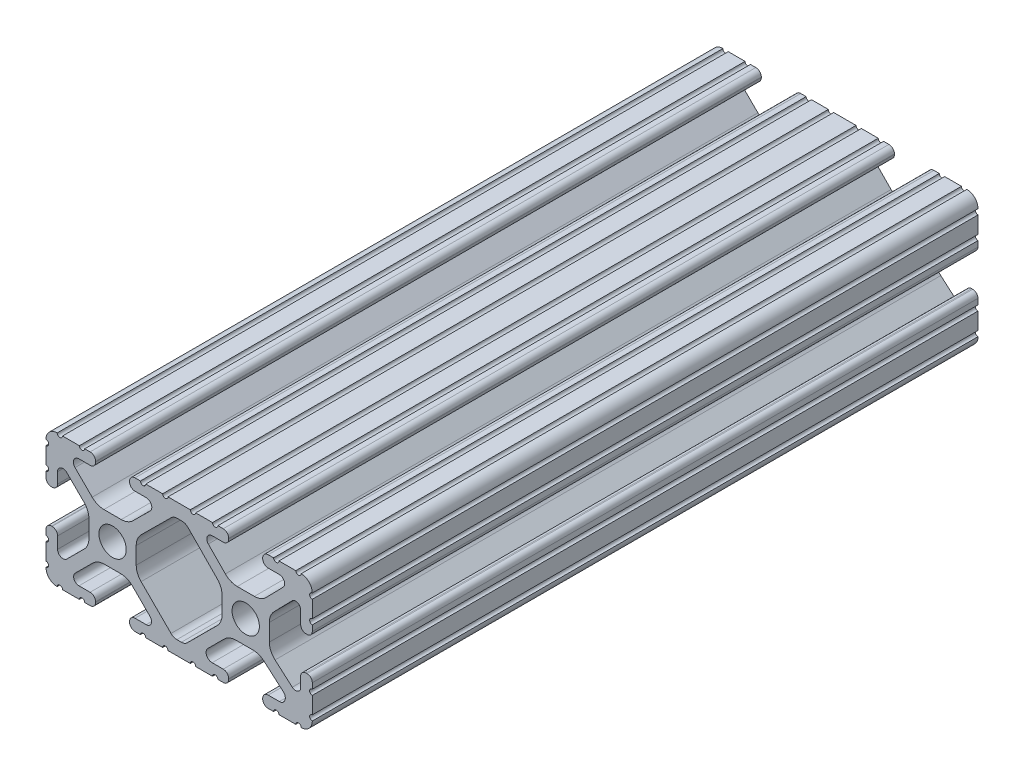
from build123d import *

# Parameters (mm, degrees)
SKETCH1_R           = 2.6035
BOSS_EXTRUDE1_DEPTH = 63.5


with BuildPart() as part:
    # Sketch1 → Boss-Extrude1 (new, symmetric)
    with BuildSketch(Plane.XY):
        with BuildLine():
            Line((18.01710265, 12.7), (16.98745015, 12.7))
            ThreePointArc((16.98745015, 12.7), (16.245730386, 12.392769614), (15.9385, 11.65104985))
            Line((15.9385, 11.65104985), (15.9385, 11.53922))
            ThreePointArc((15.9385, 11.53922), (16.245750844, 10.797450844), (16.98752, 10.4902))
            Line((16.98752, 10.4902), (19.116384363, 10.4902))
            ThreePointArc((19.116384363, 10.4902), (20.052502933, 9.869096983), (19.844087081, 8.765172272))
            Line((19.844087081, 8.765172272), (16.618993479, 5.455112286))
            ThreePointArc((16.618993479, 5.455112286), (15.578994274, 4.745442459), (14.344932584, 4.4958))
            Line((14.344932584, 4.4958), (11.083317835, 4.4958))
            ThreePointArc((11.083317835, 4.4958), (9.854330953, 4.743306833), (8.816955189, 5.447238587))
            Line((8.816955189, 5.447238587), (5.564154119, 8.762652677))
            ThreePointArc((5.564154119, 8.762652677), (5.352591412, 9.867473037), (6.289393385, 10.4902))
            Line((6.289393385, 10.4902), (8.41248, 10.4902))
            ThreePointArc((8.41248, 10.4902), (9.154249156, 10.797450844), (9.4615, 11.53922))
            Line((9.4615, 11.53922), (9.4615, 11.65104985))
            ThreePointArc((9.4615, 11.65104985), (9.154269614, 12.392769614), (8.41254985, 12.7))
            Line((8.41254985, 12.7), (7.38288465, 12.7))
            ThreePointArc((7.38288465, 12.7), (6.87488465, 12.192), (6.36688465, 12.7))
            Line((6.36688465, 12.7), (3.14958095, 12.7))
            ThreePointArc((3.14958095, 12.7), (2.64158095, 12.192), (2.13358095, 12.7))
            Line((2.13358095, 12.7), (-2.13358095, 12.7))
            ThreePointArc((-2.13358095, 12.7), (-2.64158095, 12.192), (-3.14958095, 12.7))
            Line((-3.14958095, 12.7), (-6.36689735, 12.7))
            ThreePointArc((-6.36689735, 12.7), (-6.87489735, 12.192), (-7.38289735, 12.7))
            Line((-7.38289735, 12.7), (-8.41254985, 12.7))
            ThreePointArc((-8.41254985, 12.7), (-9.154269614, 12.392769614), (-9.4615, 11.65104985))
            Line((-9.4615, 11.65104985), (-9.4615, 11.53922))
            ThreePointArc((-9.4615, 11.53922), (-9.154249156, 10.797450844), (-8.41248, 10.4902))
            Line((-8.41248, 10.4902), (-6.283641037, 10.4902))
            ThreePointArc((-6.283641037, 10.4902), (-5.297291557, 9.829633109), (-5.532576693, 8.666071843))
            Line((-5.532576693, 8.666071843), (-8.809985098, 5.416263103))
            ThreePointArc((-8.809985098, 5.416263103), (-9.836720513, 4.734920264), (-11.045536121, 4.4958))
            Line((-11.045536121, 4.4958), (-14.354463879, 4.4958))
            ThreePointArc((-14.354463879, 4.4958), (-15.563279487, 4.734920264), (-16.590014902, 5.416263103))
            Line((-16.590014902, 5.416263103), (-19.867423307, 8.666071843))
            ThreePointArc((-19.867423307, 8.666071843), (-20.102708443, 9.829633109), (-19.116358963, 10.4902))
            Line((-19.116358963, 10.4902), (-16.98752, 10.4902))
            ThreePointArc((-16.98752, 10.4902), (-16.245750844, 10.797450844), (-15.9385, 11.53922))
            Line((-15.9385, 11.53922), (-15.9385, 11.65104985))
            ThreePointArc((-15.9385, 11.65104985), (-16.245730386, 12.392769614), (-16.98745015, 12.7))
            Line((-16.98745015, 12.7), (-18.01711535, 12.7))
            ThreePointArc((-18.01711535, 12.7), (-18.52511535, 12.192), (-19.03311535, 12.7))
            Line((-19.03311535, 12.7), (-22.2504, 12.7))
            ThreePointArc((-22.2504, 12.7), (-22.758323491, 12.192000006), (-23.266399977, 12.699846982))
            ThreePointArc((-23.266399977, 12.699846982), (-24.782522516, 12.082522516), (-25.399846982, 10.566399977))
            ThreePointArc((-25.399846982, 10.566399977), (-24.892000006, 10.058323491), (-25.4, 9.5504))
            Line((-25.4, 9.5504), (-25.4, 6.3330836))
            ThreePointArc((-25.4, 6.3330836), (-24.892, 5.8250836), (-25.4, 5.3170836))
            Line((-25.4, 5.3170836), (-25.4, 4.237520184))
            ThreePointArc((-25.4, 4.237520184), (-25.107393763, 3.531106237), (-24.400979816, 3.2385))
            Line((-24.400979816, 3.2385), (-24.23922, 3.2385))
            ThreePointArc((-24.23922, 3.2385), (-23.497450844, 3.545750844), (-23.1902, 4.28752))
            Line((-23.1902, 4.28752), (-23.1902, 6.334741132))
            ThreePointArc((-23.1902, 6.334741132), (-22.556026952, 7.286023527), (-21.434002553, 7.066535717))
            Line((-21.434002553, 7.066535717), (-18.147950853, 3.808156468))
            ThreePointArc((-18.147950853, 3.808156468), (-17.452759693, 2.774838327), (-17.208501877, 1.553619571))
            Line((-17.208501877, 1.553619571), (-17.208501877, -1.695179196))
            ThreePointArc((-17.208501877, -1.695179196), (-17.450738657, -2.911536421), (-18.140486065, -3.942289578))
            Line((-18.140486065, -3.942289578), (-21.431579576, -7.227386226))
            ThreePointArc((-21.431579576, -7.227386226), (-22.55444896, -7.449940594), (-23.1902, -6.498002195))
            Line((-23.1902, -6.498002195), (-23.1902, -4.28752))
            ThreePointArc((-23.1902, -4.28752), (-23.497450844, -3.545750844), (-24.23922, -3.2385))
            Line((-24.23922, -3.2385), (-24.35098, -3.2385))
            ThreePointArc((-24.35098, -3.2385), (-25.092749156, -3.545750844), (-25.4, -4.28752))
            Line((-25.4, -4.28752), (-25.4, -5.3171344))
            ThreePointArc((-25.4, -5.3171344), (-24.892, -5.8251344), (-25.4, -6.3331344))
            Line((-25.4, -6.3331344), (-25.4, -9.5504))
            ThreePointArc((-25.4, -9.5504), (-24.892000006, -10.058323491), (-25.399846982, -10.566399977))
            ThreePointArc((-25.399846982, -10.566399977), (-24.782522516, -12.082522516), (-23.266399977, -12.699846982))
            ThreePointArc((-23.266399977, -12.699846982), (-22.758323491, -12.192000006), (-22.2504, -12.7))
            Line((-22.2504, -12.7), (-19.03308995, -12.7))
            ThreePointArc((-19.03308995, -12.7), (-18.52508995, -12.192), (-18.01708995, -12.7))
            Line((-18.01708995, -12.7), (-16.9874692, -12.7))
            ThreePointArc((-16.9874692, -12.7), (-16.245700044, -12.392749156), (-15.9384492, -11.65098))
            Line((-15.9384492, -11.65098), (-15.9384492, -11.53922))
            ThreePointArc((-15.9384492, -11.53922), (-16.245700044, -10.797450844), (-16.9874692, -10.4902))
            Line((-16.9874692, -10.4902), (-19.116358963, -10.4902))
            ThreePointArc((-19.116358963, -10.4902), (-20.055197748, -9.862578342), (-19.834124023, -8.755124678))
            Line((-19.834124023, -8.755124678), (-16.49660751, -5.423689618))
            ThreePointArc((-16.49660751, -5.423689618), (-15.467274017, -4.736928798), (-14.253591699, -4.4958))
            Line((-14.253591699, -4.4958), (-11.146408301, -4.4958))
            ThreePointArc((-11.146408301, -4.4958), (-9.932725983, -4.736928798), (-8.90339249, -5.423689618))
            Line((-8.90339249, -5.423689618), (-5.565875977, -8.755124678))
            ThreePointArc((-5.565875977, -8.755124678), (-5.344802252, -9.862578342), (-6.283641037, -10.4902))
            Line((-6.283641037, -10.4902), (-8.4125308, -10.4902))
            ThreePointArc((-8.4125308, -10.4902), (-9.154299956, -10.797450844), (-9.4615508, -11.53922))
            Line((-9.4615508, -11.53922), (-9.4615508, -11.65098))
            ThreePointArc((-9.4615508, -11.65098), (-9.154299956, -12.392749156), (-8.4125308, -12.7))
            Line((-8.4125308, -12.7), (-7.38287195, -12.7))
            ThreePointArc((-7.38287195, -12.7), (-6.87487195, -12.192), (-6.36687195, -12.7))
            Line((-6.36687195, -12.7), (-3.14960635, -12.7))
            ThreePointArc((-3.14960635, -12.7), (-2.64160635, -12.192), (-2.13360635, -12.7))
            Line((-2.13360635, -12.7), (2.13360635, -12.7))
            ThreePointArc((2.13360635, -12.7), (2.64159365, -12.1920127), (3.14958095, -12.7))
            Line((3.14958095, -12.7), (6.36691005, -12.7))
            ThreePointArc((6.36691005, -12.7), (6.87491005, -12.192), (7.38291005, -12.7))
            Line((7.38291005, -12.7), (8.4125308, -12.7))
            ThreePointArc((8.4125308, -12.7), (9.154299956, -12.392749156), (9.4615508, -11.65098))
            Line((9.4615508, -11.65098), (9.4615508, -11.53922))
            ThreePointArc((9.4615508, -11.53922), (9.154299956, -10.797450844), (8.4125308, -10.4902))
            Line((8.4125308, -10.4902), (6.289393385, -10.4902))
            ThreePointArc((6.289393385, -10.4902), (5.231590322, -9.783049717), (5.480677245, -8.535265862))
            Line((5.480677245, -8.535265862), (8.597933595, -5.423689618))
            ThreePointArc((8.597933595, -5.423689618), (9.627267088, -4.736928798), (10.840949406, -4.4958))
            Line((10.840949406, -4.4958), (14.102564155, -4.4958))
            ThreePointArc((14.102564155, -4.4958), (15.215927525, -4.697410182), (16.187895372, -5.276636531))
            Line((16.187895372, -5.276636531), (19.868247549, -8.482246082))
            ThreePointArc((19.868247549, -8.482246082), (20.188435806, -9.746879864), (19.116384363, -10.4902))
            Line((19.116384363, -10.4902), (16.9874692, -10.4902))
            ThreePointArc((16.9874692, -10.4902), (16.245700044, -10.797450844), (15.9384492, -11.53922))
            Line((15.9384492, -11.53922), (15.9384492, -11.65098))
            ThreePointArc((15.9384492, -11.65098), (16.245700044, -12.392749156), (16.9874692, -12.7))
            Line((16.9874692, -12.7), (18.01710265, -12.7))
            ThreePointArc((18.01710265, -12.7), (18.52510265, -12.192), (19.03310265, -12.7))
            Line((19.03310265, -12.7), (22.2504, -12.7))
            ThreePointArc((22.2504, -12.7), (22.758323491, -12.192000006), (23.266399977, -12.699846982))
            ThreePointArc((23.266399977, -12.699846982), (24.782522516, -12.082522516), (25.399846982, -10.566399977))
            ThreePointArc((25.399846982, -10.566399977), (24.892000006, -10.058323492), (25.4, -9.550400001))
            Line((25.4, -9.550400001), (25.4, -6.333083592))
            ThreePointArc((25.4, -6.333083592), (24.892000001, -5.825083593), (25.4, -5.317083593))
            Line((25.4, -5.317083593), (25.4, -4.237520184))
            ThreePointArc((25.4, -4.237520184), (25.107393763, -3.531106237), (24.400979816, -3.2385))
            Line((24.400979816, -3.2385), (24.189220184, -3.2385))
            ThreePointArc((24.189220184, -3.2385), (23.482806237, -3.531106237), (23.1902, -4.237520184))
            Line((23.1902, -4.237520184), (23.1902, -6.155876159))
            ThreePointArc((23.1902, -6.155876159), (22.62232736, -7.038258539), (21.583974541, -6.886926384))
            Line((21.583974541, -6.886926384), (18.29817066, -4.024970844))
            ThreePointArc((18.29817066, -4.024970844), (17.493730985, -2.946044689), (17.208501877, -1.630807374))
            Line((17.208501877, -1.630807374), (17.208501877, 1.630807374))
            ThreePointArc((17.208501877, 1.630807374), (17.442348332, 2.82673414), (18.109440981, 3.846495088))
            Line((18.109440981, 3.846495088), (21.526346532, 7.353420386))
            ThreePointArc((21.526346532, 7.353420386), (22.585896263, 7.574939077), (23.1902, 6.676867167))
            Line((23.1902, 6.676867167), (23.1902, 4.237520184))
            ThreePointArc((23.1902, 4.237520184), (23.482806237, 3.531106237), (24.189220184, 3.2385))
            Line((24.189220184, 3.2385), (24.400979816, 3.2385))
            ThreePointArc((24.400979816, 3.2385), (25.107393763, 3.531106237), (25.4, 4.237520184))
            Line((25.4, 4.237520184), (25.4, 5.3170836))
            ThreePointArc((25.4, 5.3170836), (24.891949193, 5.825134407), (25.4, 6.333185215))
            Line((25.4, 6.333185215), (25.4, 9.550400015))
            ThreePointArc((25.4, 9.550400015), (24.892000013, 10.058323498), (25.399846982, 10.566399977))
            ThreePointArc((25.399846982, 10.566399977), (24.782522516, 12.082522516), (23.266399977, 12.699846982))
            ThreePointArc((23.266399977, 12.699846982), (22.758323491, 12.192000006), (22.2504, 12.7))
            Line((22.2504, 12.7), (19.03310265, 12.7))
            ThreePointArc((19.03310265, 12.7), (18.52510265, 12.192), (18.01710265, 12.7))
        make_face()
        with Locations((-12.7, 0)):
            Circle(SKETCH1_R, mode=Mode.SUBTRACT)
        with Locations((12.7, 0)):
            Circle(SKETCH1_R, mode=Mode.SUBTRACT)
        with BuildLine():
            Line((-7.259513935, -3.869413038), (-1.545748891, -9.572766749))
            ThreePointArc((-1.545748891, -9.572766749), (-1.035199478, -9.913400116), (-0.433213048, -10.033))
            Line((-0.433213048, -10.033), (0.433213048, -10.033))
            ThreePointArc((0.433213048, -10.033), (1.035199478, -9.913400116), (1.545748891, -9.572766749))
            Line((1.545748891, -9.572766749), (7.259513935, -3.869413038))
            ThreePointArc((7.259513935, -3.869413038), (7.949261343, -2.838659881), (8.191498123, -1.622302656))
            Line((8.191498123, -1.622302656), (8.191498123, 1.622302656))
            ThreePointArc((8.191498123, 1.622302656), (7.955573352, 2.823327967), (7.282860769, 3.845864069))
            Line((7.282860769, 3.845864069), (1.675572808, 9.561086461))
            ThreePointArc((1.675572808, 9.561086461), (1.161034429, 9.910236611), (0.551456936, 10.033))
            Line((0.551456936, 10.033), (-0.395199982, 10.033))
            ThreePointArc((-0.395199982, 10.033), (-0.994772524, 9.914396349), (-1.50403329, 9.576450301))
            Line((-1.50403329, 9.576450301), (-7.252049147, 3.876839553))
            ThreePointArc((-7.252049147, 3.876839553), (-7.947240307, 2.843521412), (-8.191498123, 1.622302656))
            Line((-8.191498123, 1.622302656), (-8.191498123, -1.622302656))
            ThreePointArc((-8.191498123, -1.622302656), (-7.949261343, -2.838659881), (-7.259513935, -3.869413038))
        make_face(mode=Mode.SUBTRACT)
    extrude(amount=BOSS_EXTRUDE1_DEPTH, both=True)


solid = part.part
